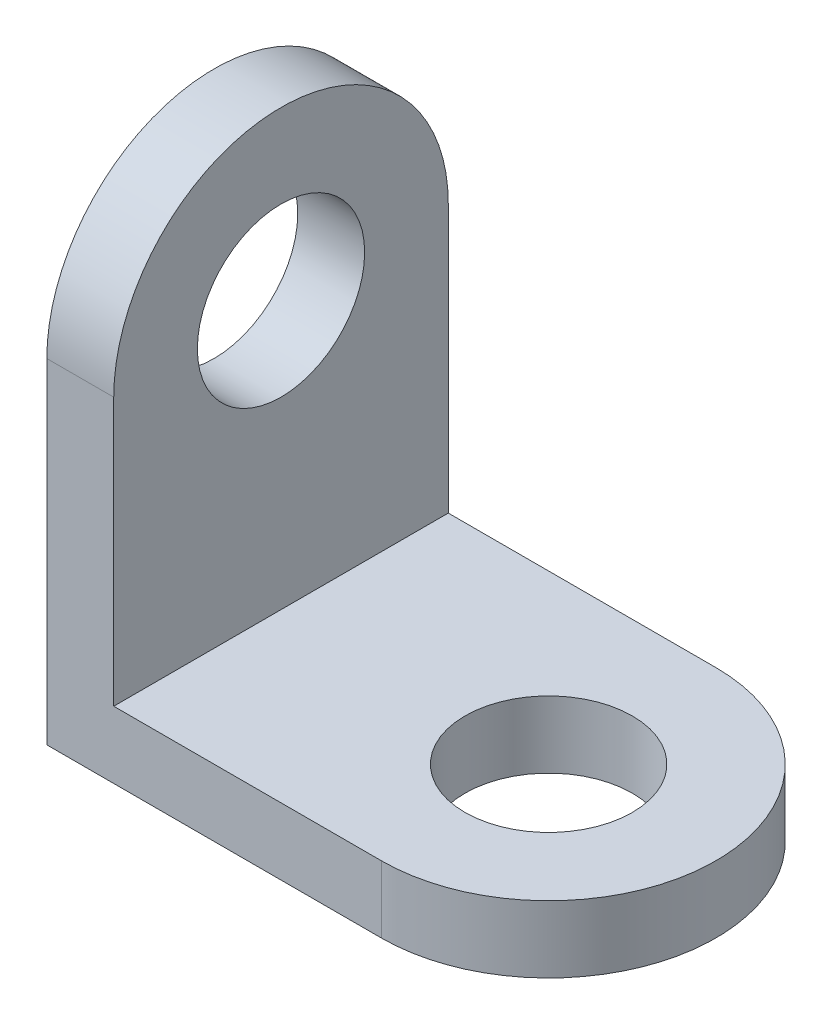
from build123d import *

# Parameters (mm, degrees)
ESBO_O1_R                = 5
ESBO_O1_R_2              = 2.5
RESSALTO_EXTRUS_O1_DEPTH = 2
ESBO_O2_R                = 2.5
RESSALTO_EXTRUS_O2_DEPTH = 2


with BuildPart() as part:
    # Esboço1 → Ressalto-extrusão1 (new body)
    # profile 1 of 2: a face of its own
    with BuildSketch(Plane(origin=(0, 0, 0), x_dir=(1, 0, 0), z_dir=(0, 1, 0))):
        with BuildLine():
            ThreePointArc((0, -5), (-5, 0), (0, 5))
            Line((0, 5), (-10, 5))
            Line((-10, 5), (-10, -5))
            Line((-10, -5), (0, -5))
        make_face()
    # profile 2 of 2: a face of its own
    with BuildSketch(Plane(origin=(0, 0, 0), x_dir=(1, 0, 0), z_dir=(0, 1, 0))):
        Circle(ESBO_O1_R)
        with Locations(Location((0, 0, 0), (0, 0, 270))):
            Circle(ESBO_O1_R_2, mode=Mode.SUBTRACT)
    extrude(amount=RESSALTO_EXTRUS_O1_DEPTH)

    # Esboço2 → Ressalto-extrusão2 (add)
    with BuildSketch(Plane.ZY.offset(10)):
        with BuildLine():
            ThreePointArc((5, 10), (0, 15), (-5, 10))
            Line((-5, 10), (-5, 2))
            Line((-5, 2), (5, 2))
            Line((5, 2), (5, 10))
        make_face()
        with Locations((0, 10)):
            Circle(ESBO_O2_R, mode=Mode.SUBTRACT)
    extrude(amount=-RESSALTO_EXTRUS_O2_DEPTH)


solid = part.part
